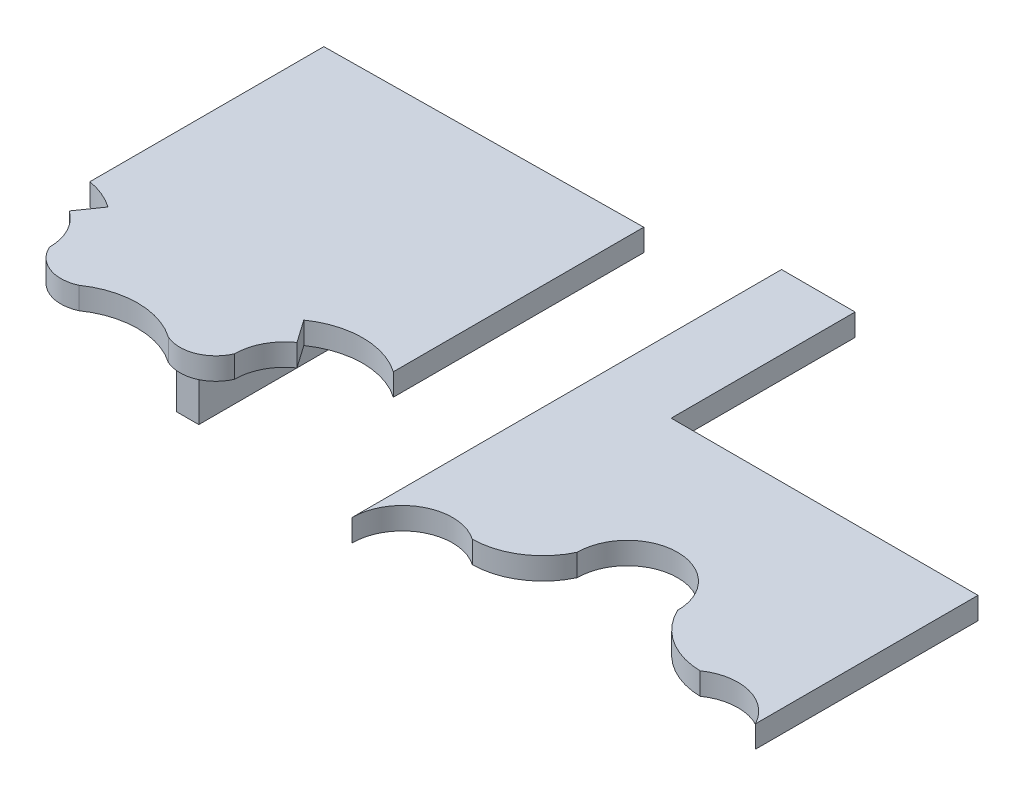
from build123d import *

# Parameters (mm, degrees)
BOSS_EXTRUDE1_DEPTH   = 3
BOSS_EXTRUDE1_2_DEPTH = 3
SKETCH3_W             = 10
SKETCH3_H             = 3
BOSS_EXTRUDE2_DEPTH   = 25
SKETCH4_W             = 3
SKETCH4_H             = 20
BOSS_EXTRUDE3_DEPTH   = 30


with BuildPart() as part:
    # Sketch1 → Boss-Extrude1 (new body)
    with BuildSketch(Plane(origin=(0, 0, 0), x_dir=(1, 0, 0), z_dir=(0, 1, 0))):
        with BuildLine():
            Line((-108.075427433, -1.564939748), (-105.906554588, 1.532531683))
            ThreePointArc((-105.906554588, 1.532531683), (-107.916571134, 2.63736717), (-110.11703504, 3.284504381))
            Line((-110.11703504, 3.284504381), (-110.11703504, 15.083193879))
            Line((-110.11703504, 15.083193879), (-110.11703504, 35.083193879))
            Line((-110.11703504, 35.083193879), (-67.11703504, 35.569089871))
            Line((-67.11703504, 35.569089871), (-67.11703504, 15.01520735))
            Line((-67.11703504, 15.01520735), (-67.11703504, 1.532531683))
            ThreePointArc((-67.11703504, 1.532531683), (-73.203871736, 3.451703921), (-79.290708431, 1.532531683))
            Line((-79.290708431, 1.532531683), (-77.121835585, -1.564939748))
            ThreePointArc((-77.121835585, -1.564939748), (-79.262831202, -4.006277352), (-80.034633255, -7.16037201))
            ThreePointArc((-80.034633255, -7.16037201), (-82.749732839, -9.766447293), (-86.511794814, -9.665038093))
            ThreePointArc((-86.511794814, -9.665038093), (-92.598631509, -7.745865855), (-98.685468204, -9.665038093))
            ThreePointArc((-98.685468204, -9.665038093), (-102.447530179, -9.766447293), (-105.162629764, -7.16037201))
            ThreePointArc((-105.162629764, -7.16037201), (-105.934431817, -4.006277352), (-108.075427433, -1.564939748))
        make_face()
    extrude(amount=BOSS_EXTRUDE1_DEPTH)

    # Sketch4 → Boss-Extrude3 (add)
    with BuildSketch(Plane.XZ):
        with Locations((-108.61703504, -25.083193879)):
            Rectangle(SKETCH4_W, SKETCH4_H)
    extrude(amount=BOSS_EXTRUDE3_DEPTH)


with BuildPart() as body_2:
    # Sketch1 → Boss-Extrude1 2 (new body)
    with BuildSketch(Plane(origin=(0, 0, 0), x_dir=(1, 0, 0), z_dir=(0, 1, 0))):
        with BuildLine():
            Line((-52.770658442, -18.42256832), (-52.770658442, 14.950580817))
            Line((-52.770658442, 14.950580817), (-1.06354068, 14.950580817))
            Line((-1.06354068, 14.950580817), (-1.06354068, -15.322613163))
            ThreePointArc((-1.06354068, -15.322613163), (-5.491565113, -11.796283931), (-11.058747651, -12.820430807))
            ThreePointArc((-11.058747651, -12.820430807), (-16.18555762, -11.25868924), (-19.71437563, -7.224998544))
            ThreePointArc((-19.71437563, -7.224998544), (-26.545137149, -0.394237025), (-33.375898669, -7.224998544))
            ThreePointArc((-33.375898669, -7.224998544), (-36.904716678, -11.25868924), (-42.031526647, -12.820430807))
            ThreePointArc((-42.031526647, -12.820430807), (-49.099181466, -12.366313363), (-52.770658442, -18.42256832))
        make_face()
    extrude(amount=BOSS_EXTRUDE1_2_DEPTH)

    # Sketch3 → Boss-Extrude2 (add)
    with BuildSketch(Plane(origin=(0, 0, -14.950580817), x_dir=(-1, 0, 0), z_dir=(0, 0, -1))):
        with Locations((47.770658442, 1.5)):
            Rectangle(SKETCH3_W, SKETCH3_H)
    extrude(amount=BOSS_EXTRUDE2_DEPTH)


solid = Compound([part.part, body_2.part])
